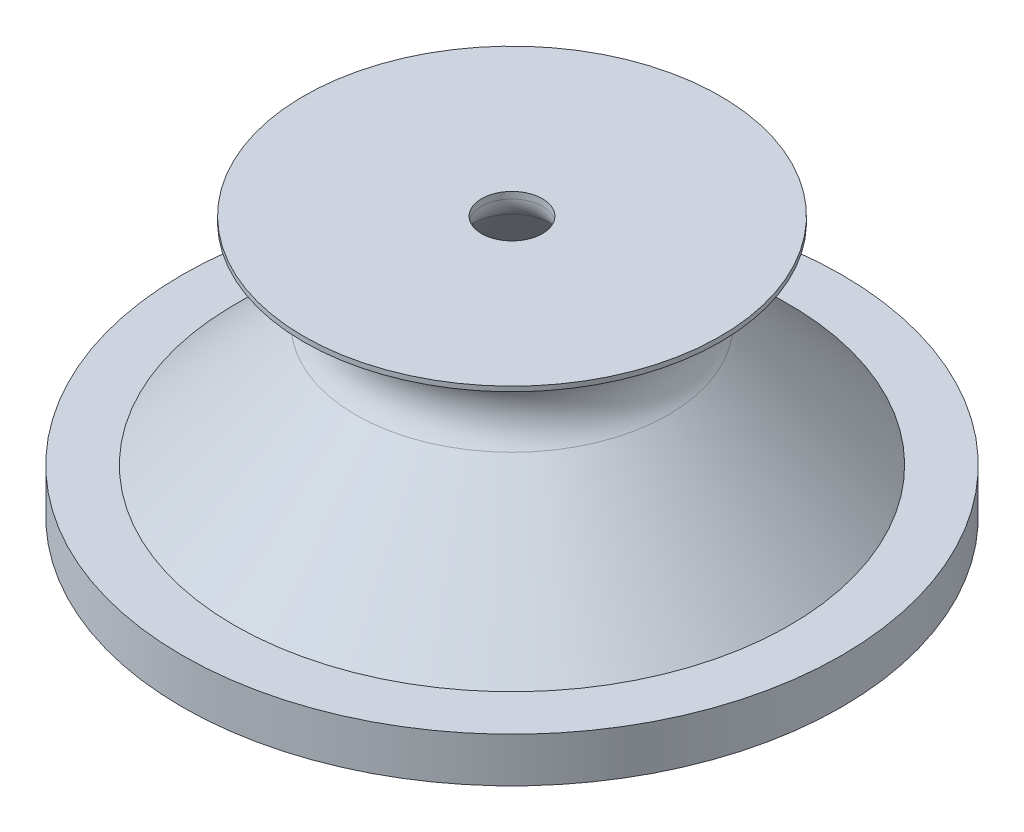
from build123d import *


with BuildPart() as part:
    # Esquisse1 → Révolution1 (revolve)
    with BuildSketch(Plane.XY):
        with BuildLine():
            Line((31.5, 0), (38, 0))
            Line((38, 0), (38, 5.156854249))
            Line((38, 5.156854249), (32, 5.156854249))
            Line((32, 5.156854249), (17.99973552, 19.157118729))
            ThreePointArc((17.99973552, 19.157118729), (16.626709378, 23.64451305), (19.57751766, 27.293436049))
            ThreePointArc((19.57751766, 27.293436049), (21.815123989, 28.31126724), (24, 29.43784579))
            Line((24, 29.43784579), (24, 30))
            Line((24, 30), (3.5, 30))
            Line((3.5, 30), (3.5, 29.242640687))
            ThreePointArc((3.5, 29.242640687), (3.728361402, 28.09459039), (4.378679656, 27.121320344))
            Line((4.378679656, 27.121320344), (31.5, 0))
        make_face()
    revolve(axis=Axis((0, 49.284488144, 0), (0, -1, 0)))


solid = part.part
